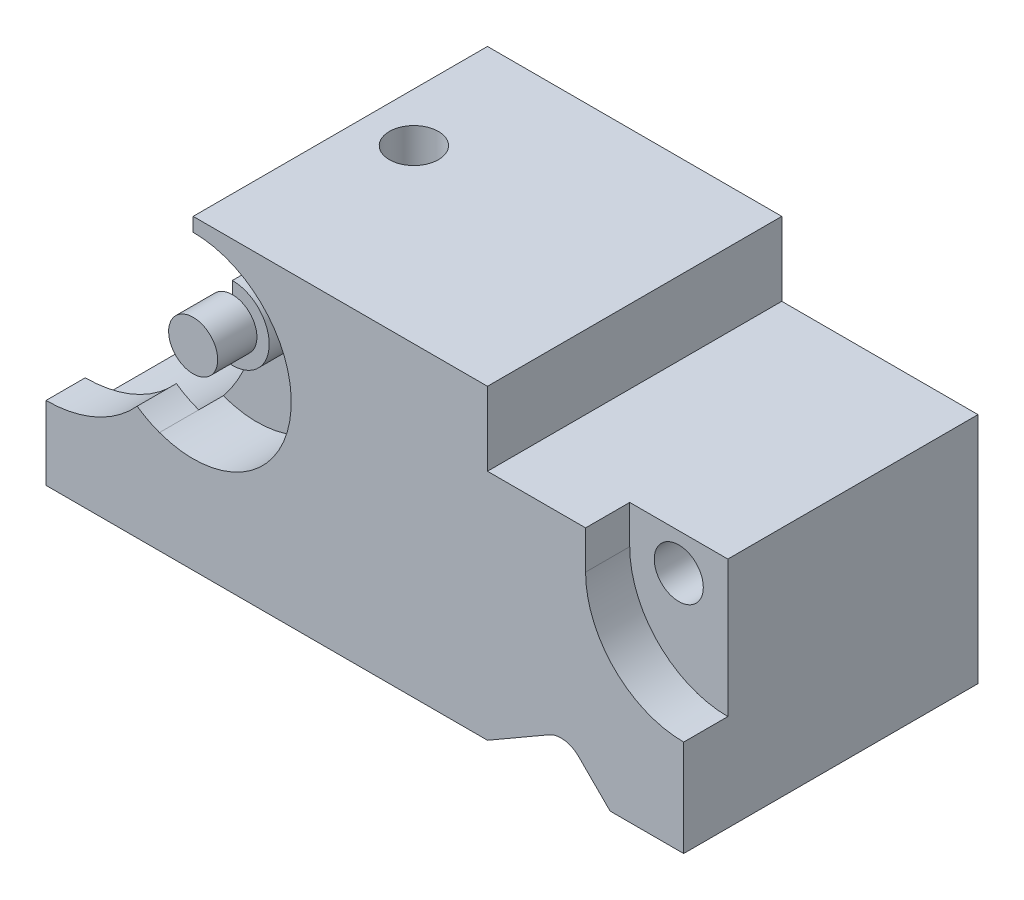
from build123d import *

# Parameters (mm, degrees)
BOSS_EXTRUDE1_DEPTH      = 30
BOSS_EXTRUDE1_DEPTH_BACK = 30
CUT_EXTRUDE1_DEPTH       = 13
BOSS_EXTRUDE2_START      = -8
BOSS_EXTRUDE2_DEPTH      = 8
BOSS_EXTRUDE3_DEPTH      = 5
SKETCH5_R                = 5
BOSS_EXTRUDE4_DEPTH      = 8
CUT_EXTRUDE2_DEPTH       = 9
SKETCH7_R                = 5
CUT_EXTRUDE3_DEPTH       = 104.596573302
SKETCH8_R                = 5
CUT_EXTRUDE4_DEPTH       = 96.032889044
CUT_EXTRUDE5_DEPTH       = 109.310895112


with BuildPart() as part:
    # Sketch1 → Boss-Extrude1 (new, two sides: drawn at the far end of the back side and taken through both)
    with BuildSketch(Plane.XY.offset(-BOSS_EXTRUDE1_DEPTH_BACK)):
        with BuildLine():
            Line((-65, 9.998359599), (-65, 0))
            Line((-65, 0), (65, 0))
            Line((65, 0), (65, 47.5))
            Line((65, 47.5), (25, 47.5))
            Line((25, 47.5), (25, 62.5))
            Line((25, 62.5), (-35, 62.5))
            Line((-35, 62.5), (-35, 39.686269666))
            ThreePointArc((-35, 39.686269666), (-43.896848552, 18.675004673), (-65, 9.998359599))
        make_face()
    extrude(amount=BOSS_EXTRUDE1_DEPTH + BOSS_EXTRUDE1_DEPTH_BACK)

    # Sketch2 → Cut-Extrude1 (cut)
    with BuildSketch(Plane.XY.offset(30)):
        with BuildLine():
            Line((-35, 59.686269666), (-35.00136791, 39.71351659))
            ThreePointArc((-35.00136791, 39.71351659), (-36.817077306, 29.717837367), (-41.86475429, 20.901298318))
            ThreePointArc((-41.86475429, 20.901298318), (-15.306099587, 36.200543555), (-35, 59.686269666))
        make_face()
    extrude(amount=-CUT_EXTRUDE1_DEPTH, mode=Mode.SUBTRACT)

    # Sketch3 → Boss-Extrude2 (add)
    with BuildSketch(Plane.XY.offset(30).offset(BOSS_EXTRUDE2_START)):
        with BuildLine():
            Line((-65, 9.998359599), (-65, 15))
            ThreePointArc((-65, 15), (-54.833160932, 17.160661495), (-46.42368968, 23.269169331))
            ThreePointArc((-46.42368968, 23.269169331), (-44.219987435, 21.937644338), (-41.863489254, 20.900254001))
            ThreePointArc((-41.863489254, 20.900254001), (-52.211827427, 12.860341399), (-65, 9.998359599))
        make_face()
    extrude(amount=BOSS_EXTRUDE2_DEPTH)

    # Sketch4 → Boss-Extrude3 (add)
    with BuildSketch(Plane.XY.offset(17)):
        with BuildLine():
            Line((-35, 47.186269666), (-35, 39.686269666))
            ThreePointArc((-35, 39.686269666), (-35.235297751, 35.936269666), (-35.9375, 32.245094104))
            ThreePointArc((-35.9375, 32.245094104), (-27.514720556, 39.216597822), (-35, 47.186269666))
        make_face()
    extrude(amount=BOSS_EXTRUDE3_DEPTH)

    # Sketch5 → Boss-Extrude4 (add)
    with BuildSketch(Plane.XY.offset(22)):
        with Locations((-35, 39.686269666)):
            Circle(SKETCH5_R)
    extrude(amount=BOSS_EXTRUDE4_DEPTH)

    # Sketch6 → Cut-Extrude2 (cut)
    with BuildSketch(Plane.XY.offset(30)):
        with BuildLine():
            Line((65, 47.5), (45, 47.5))
            Line((45, 47.5), (45, 39.686269666))
            ThreePointArc((45, 39.686269666), (50.857864376, 25.544134042), (65, 19.686269666))
            Line((65, 19.686269666), (65, 39.686269666))
            Line((65, 39.686269666), (65, 47.5))
        make_face()
    extrude(amount=-CUT_EXTRUDE2_DEPTH, mode=Mode.SUBTRACT)

    # Sketch7 → Cut-Extrude3 (cut, through all)
    with BuildSketch(Plane.XY.offset(21)):
        with Locations((55, 40)):
            Circle(SKETCH7_R)
    extrude(amount=-CUT_EXTRUDE3_DEPTH, mode=Mode.SUBTRACT)

    # Sketch8 → Cut-Extrude4 (cut, through all)
    with BuildSketch(Plane(origin=(0, 62.5, 0), x_dir=(1, 0, 0), z_dir=(0, 1, 0))):
        with Locations((-25, 5)):
            Circle(SKETCH8_R)
    extrude(amount=-CUT_EXTRUDE4_DEPTH, mode=Mode.SUBTRACT)

    # Sketch9 → Cut-Extrude5 (cut, through all)
    with BuildSketch(Plane.XY.offset(30)):
        with BuildLine():
            Line((25, 0), (50, 0))
            Line((50, 0), (43.562275488, 6.437724512))
            ThreePointArc((43.562275488, 6.437724512), (40.679372543, 7.859414913), (37.526741582, 7.232317625))
            Line((37.526741582, 7.232317625), (25, 0))
        make_face()
    extrude(amount=-CUT_EXTRUDE5_DEPTH, mode=Mode.SUBTRACT)


solid = part.part
